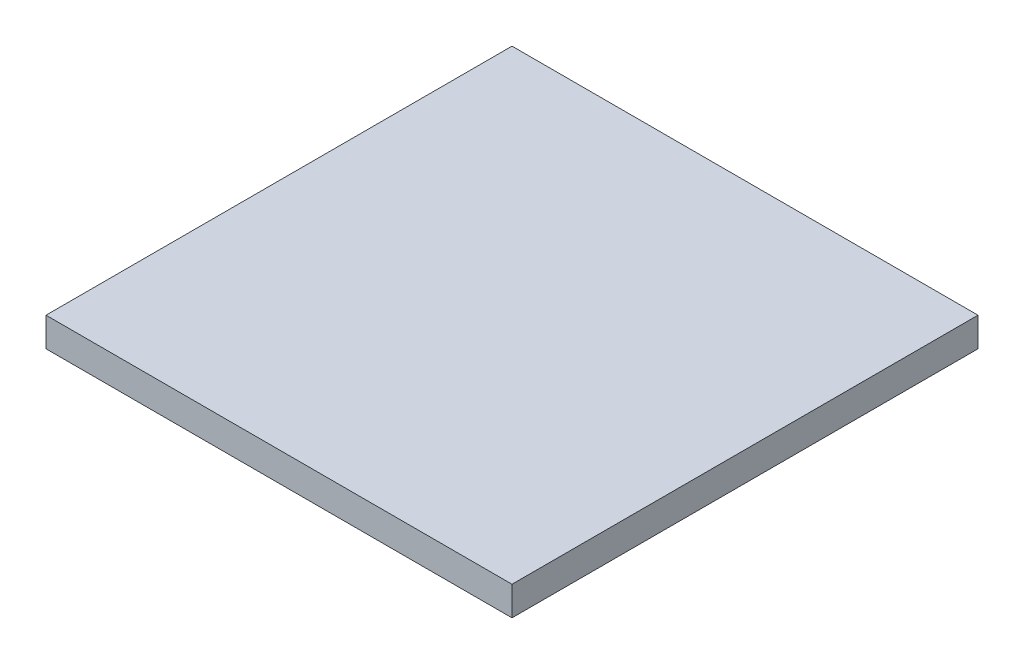
from build123d import *

# Parameters (mm, degrees)
SKETCH2_W           = 304.8
SKETCH2_H           = 304.8
BOSS_EXTRUDE2_DEPTH = 19.05


with BuildPart() as part:
    # Sketch2 → Boss-Extrude2 (new body)
    with BuildSketch(Plane(origin=(0, 0, 0), x_dir=(1, 0, 0), z_dir=(0, 1, 0))):
        with Locations((152.4, -152.4)):
            Rectangle(SKETCH2_W, SKETCH2_H)
    extrude(amount=BOSS_EXTRUDE2_DEPTH)


solid = part.part
